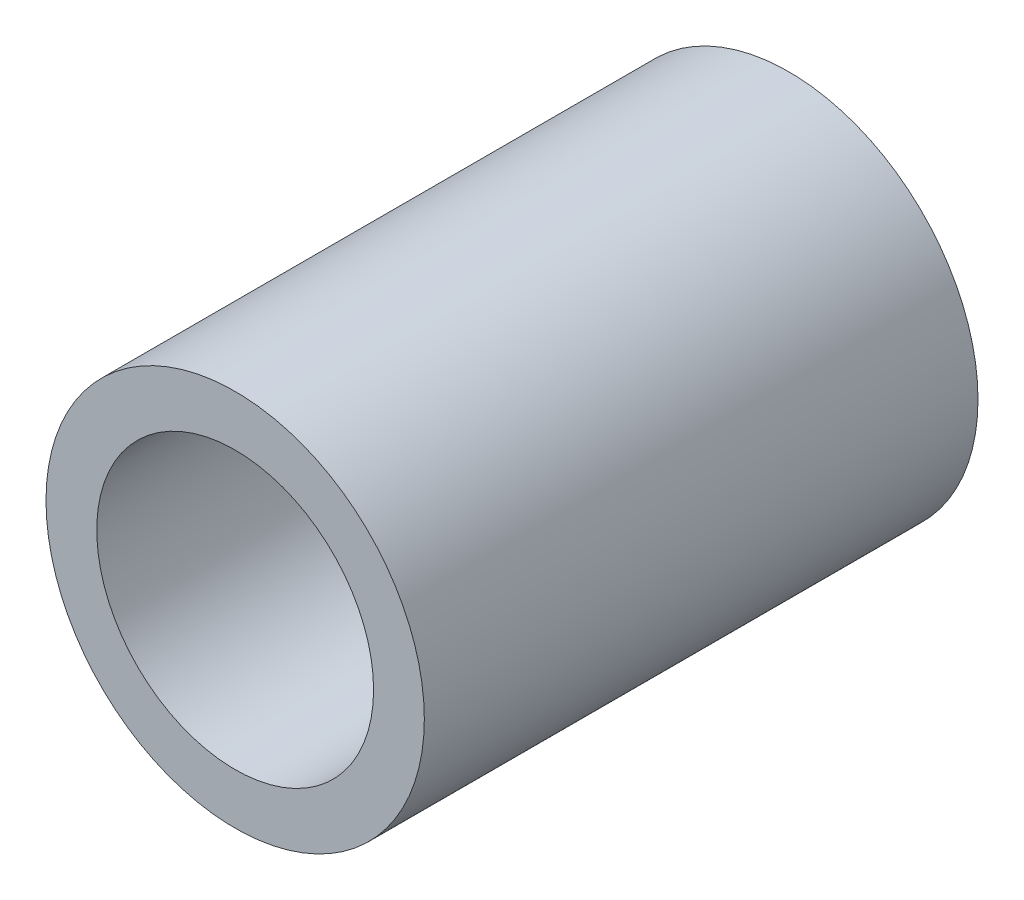
from build123d import *

# Parameters (mm, degrees)
SKETCH1_R           = 41
BOSS_EXTRUDE1_DEPTH = 120
SKETCH2_R           = 30
CUT_EXTRUDE1_DEPTH  = 130


with BuildPart() as part:
    # Sketch1 → Boss-Extrude1 (new body)
    with BuildSketch(Plane.XY):
        Circle(SKETCH1_R)
    extrude(amount=BOSS_EXTRUDE1_DEPTH)

    # Sketch2 → Cut-Extrude1 (cut)
    with BuildSketch(Plane.XY.offset(120)):
        Circle(SKETCH2_R)
    extrude(amount=-CUT_EXTRUDE1_DEPTH, mode=Mode.SUBTRACT)


solid = part.part
